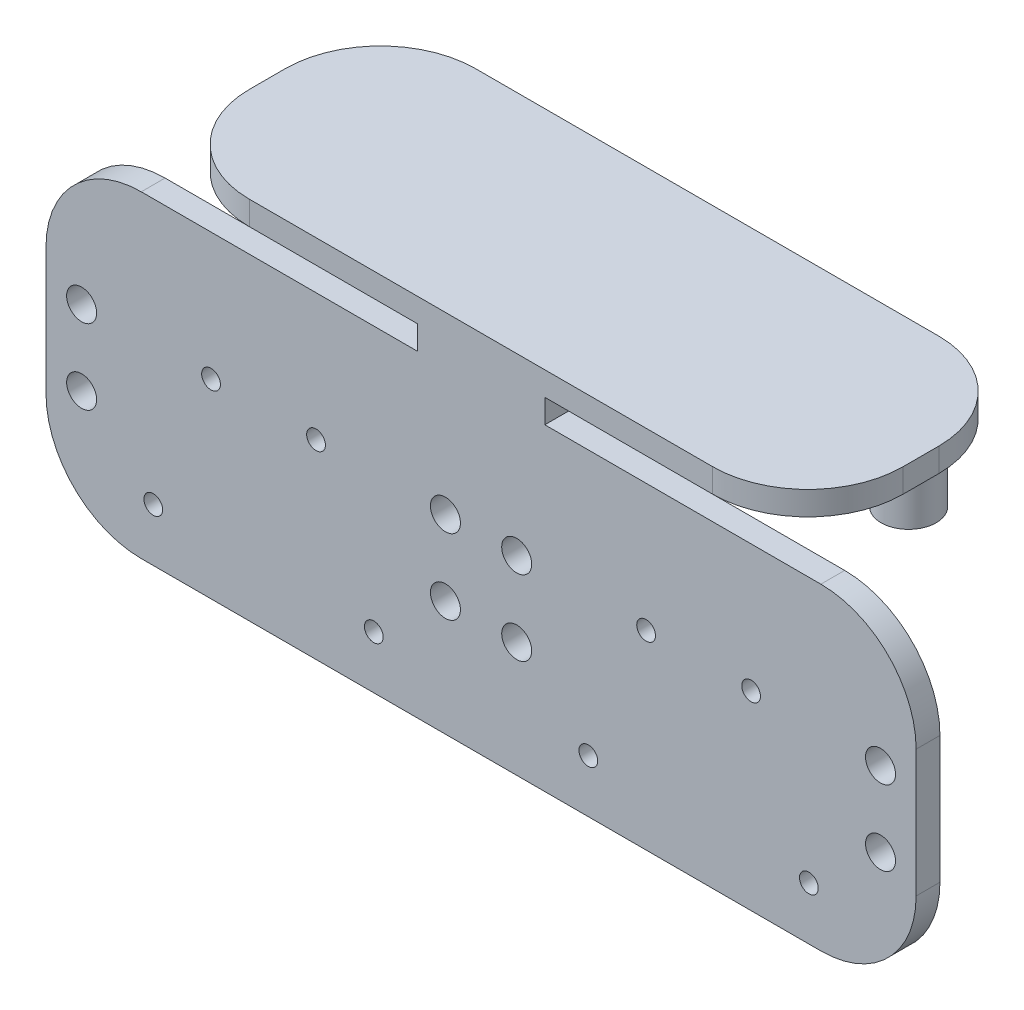
from build123d import *

# Parameters (mm, degrees)
SKETCH1_W             = 116
SKETCH1_H             = 48.6986
BOSS_EXTRUDE1_DEPTH   = 3.175
SKETCH2_W             = 14.431210835
SKETCH2_H             = 6.35
CUT_EXTRUDE1_DEPTH    = 95.79098388
SKETCH3_W             = 14.431210835
SKETCH3_H             = 6.35
CUT_EXTRUDE2_DEPTH    = 95.79098388
SKETCH4_W             = 87.13757833
SKETCH4_H             = 3.175
BOSS_EXTRUDE2_DEPTH   = 26.9748
SKETCH5_W             = 3.678354521
SKETCH5_H             = 6.35
SKETCH6_W             = 3.671158805
SKETCH6_H             = 6.35
F_2_CLEARANCE_HOLE1_D = 2.5
F_6_CLEARANCE_HOLE1_D = 4
SKETCH11_W            = 17
SKETCH11_H            = 4
BOSS_EXTRUDE3_DEPTH   = 5.715
SKETCH12_W            = 17
SKETCH12_H            = 3.715
BOSS_EXTRUDE4_DEPTH   = 19.05
SKETCH13_R            = 2
CUT_EXTRUDE3_DEPTH    = 98.974438682
SKETCH14_W            = 35.068789165
SKETCH14_H            = 3.175
CUT_EXTRUDE4_DEPTH    = 3.175
FILLET1_R             = 12.7


with BuildPart() as part:
    # Sketch1 → Boss-Extrude1 (new body)
    with BuildSketch(Plane(origin=(0, 0, 0), x_dir=(-1, 0, 0), z_dir=(0, 0, -1))):
        with Locations((29, -13.1507)):
            Rectangle(SKETCH1_W, SKETCH1_H)
    extrude(amount=-BOSS_EXTRUDE1_DEPTH)

    # Sketch2 → Cut-Extrude1 (cut, through all)
    with BuildSketch(Plane.XY.offset(3.175)):
        with Locations((21.784394583, 8.0236)):
            Rectangle(SKETCH2_W, SKETCH2_H)
    extrude(amount=-CUT_EXTRUDE1_DEPTH, mode=Mode.SUBTRACT)

    # Sketch3 → Cut-Extrude2 (cut, through all)
    with BuildSketch(Plane.XY.offset(3.175)):
        with Locations((-79.784394582, 8.0236)):
            Rectangle(SKETCH3_W, SKETCH3_H)
    extrude(amount=-CUT_EXTRUDE2_DEPTH, mode=Mode.SUBTRACT)

    # Sketch4 → Boss-Extrude2 (add)
    with BuildSketch(Plane(origin=(0, 0, 0), x_dir=(-1, 0, 0), z_dir=(0, 0, -1))):
        with Locations((29, 9.6111)):
            Rectangle(SKETCH4_W, SKETCH4_H)
    extrude(amount=BOSS_EXTRUDE2_DEPTH)

    # Sketch5 → Revolve1 (revolve)
    with BuildSketch(Plane(origin=(0, 0, -14.77), x_dir=(-1, 0, 0), z_dir=(0, 0, -1)), mode=Mode.PRIVATE) as revolve1_sk:
        with Locations((-11.889177261, 4.8486)):
            Rectangle(SKETCH5_W, SKETCH5_H)
    revolve(revolve1_sk.sketch.rotate(Axis((10.05, 1.6736, -14.77), (0, 1, 0)), 270), axis=Axis((10.05, 1.6736, -14.77), (0, 1, 0)))

    # Sketch6 → Revolve2 (revolve)
    with BuildSketch(Plane(origin=(0, 0, -14.97), x_dir=(-1, 0, 0), z_dir=(0, 0, -1)), mode=Mode.PRIVATE) as revolve2_sk:
        with Locations((66.214420598, 4.8486)):
            Rectangle(SKETCH6_W, SKETCH6_H)
    revolve(revolve2_sk.sketch.rotate(Axis((-68.05, 1.6736, -14.97), (0, 1, 0)), 270), axis=Axis((-68.05, 1.6736, -14.97), (0, 1, 0)))

    # #2 Clearance Hole1 (through all)
    with Locations(Plane(origin=(0, 0, 0), x_dir=(-1, 0, 0), z_dir=(0, 0, -1))):
        with Locations((72.699747468, -30.449747468), (65, -12.13), (51, -12.13), (43.300252532, -30.449747468), (14.699747468, -30.449747468), (7, -12.13), (-7, -12.13), (-14.699747468, -30.449747468)):
            Hole(F_2_CLEARANCE_HOLE1_D / 2)

    # #6 Clearance Hole1 (through all)
    with Locations(Plane(origin=(0, 0, 0), x_dir=(-1, 0, 0), z_dir=(0, 0, -1))):
        with Locations((33.75, -22.13), (82.25, -12.13), (82.25, -22.13), (-24.25, -12.13), (24.25, -12.13), (24.25, -22.13), (33.75, -12.13), (-24.25, -22.13)):
            Hole(F_6_CLEARANCE_HOLE1_D / 2)

    # Sketch11 → Boss-Extrude3 (add)
    with BuildSketch(Plane(origin=(0, 0, 0), x_dir=(-1, 0, 0), z_dir=(0, 0, -1))):
        with Locations((29, -5)):
            Rectangle(SKETCH11_W, SKETCH11_H)
    extrude(amount=BOSS_EXTRUDE3_DEPTH)

    # Sketch12 → Boss-Extrude4 (add)
    with BuildSketch(Plane.XZ.offset(7)):
        with Locations((-29, -3.8575)):
            Rectangle(SKETCH12_W, SKETCH12_H)
    extrude(amount=BOSS_EXTRUDE4_DEPTH)

    # Sketch13 → Cut-Extrude3 (cut, through all)
    with BuildSketch(Plane.XY.offset(-2)):
        with Locations(Location((-33.75, -12.13, 0), (0, 0, 180))):
            Circle(SKETCH13_R)
        with Locations(Location((-24.25, -12.13, 0), (0, 0, 180))):
            Circle(SKETCH13_R)
        with Locations(Location((-24.25, -22.13, 0), (0, 0, 180))):
            Circle(SKETCH13_R)
        with Locations(Location((-33.75, -22.13, 0), (0, 0, 180))):
            Circle(SKETCH13_R)
    extrude(amount=-CUT_EXTRUDE3_DEPTH, mode=Mode.SUBTRACT)

    # Sketch14 → Cut-Extrude4 (cut)
    with BuildSketch(Plane(origin=(0, 0, 0), x_dir=(-1, 0, 0), z_dir=(0, 0, -1))):
        with Locations((2.965605417, 6.4361)):
            Rectangle(SKETCH14_W, SKETCH14_H)
        with Locations((55.034394582, 6.4361)):
            Rectangle(SKETCH14_W, SKETCH14_H)
    extrude(amount=-CUT_EXTRUDE4_DEPTH, mode=Mode.SUBTRACT)

    # Fillet1
    fillet1_edges = [part.edges().sort_by_distance(p)[0] for p in [
        (29, 4.8486, 1.5875),
        (14.568789165, 9.6111, 3.175),
        (-72.568789165, 9.6111, 3.175),
        (-87, 4.8486, 1.5875),
        (-72.568789165, 9.6111, -26.9748),
        (14.568789165, 9.6111, -26.9748),
        (29, -37.5, 1.5875),
        (-87, -37.5, 1.5875),
    ]]
    fillet(fillet1_edges, radius=FILLET1_R)


solid = part.part
